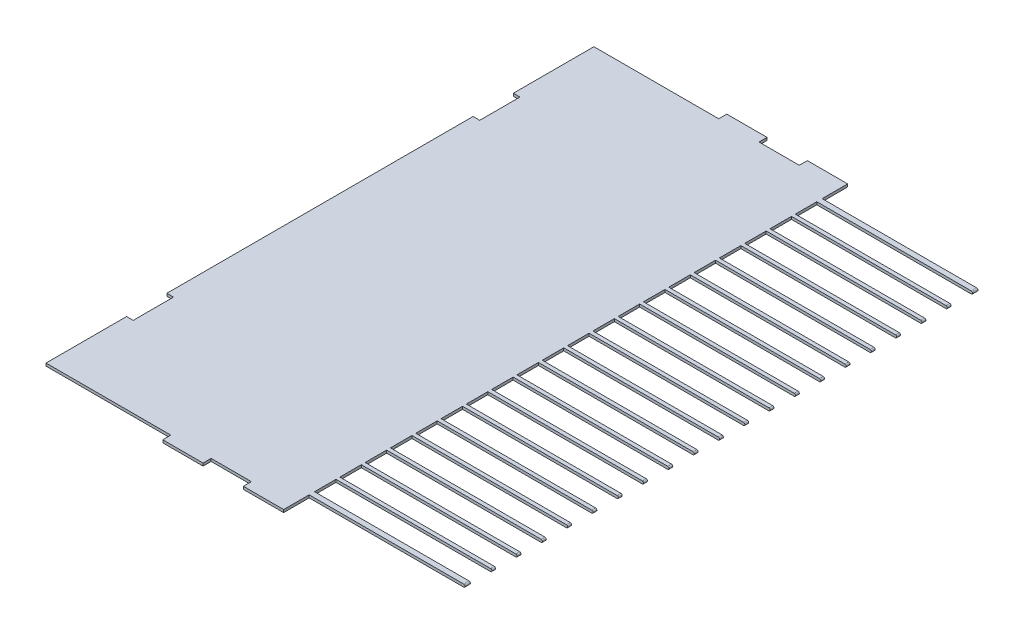
from build123d import *

# Parameters (mm, degrees)
EXTRUDE_1_DEPTH     = 0.5
EXTRUDE_2_DEPTH     = 104.5
SKETCH_8_W          = 60
SKETCH_8_H          = 8
SKETCH_8_W_2        = 60.000005443
CUT_EXTRUDE_2_DEPTH = 10
EXTRUDE_4_DEPTH     = 2.5
SKETCH_7_R          = 3.5
SKETCH_7_R_2        = 0.5
CUT_EXTRUDE_4_DEPTH = 244
SKETCH_10_W         = 3
SKETCH_10_H         = 95.004122321
SKETCH_10_H_2       = 102.964943566
CUT_EXTRUDE_5_DEPTH = 284
SKETCH_11_W         = 204
SKETCH_11_H         = 57
CUT_EXTRUDE_6_DEPTH = 284
SKETCH_13_W         = 2.47
SKETCH_13_H         = 15
CUT_EXTRUDE_7_DEPTH = 284
SKETCH_14_W         = 15
SKETCH_14_H         = 3
EXTRUDE_5_DEPTH     = 1


with BuildPart() as part:
    # 草图1 → 凸台-拉伸1 (new body)
    with BuildSketch(Plane.XY):
        Polygon((0, -1.078212291), (0, -59.078212291), (150, -59.078212291), (150, -56.078212291), (24.720670391, -21.433997855), (24.720670391, -1.078212291), align=None)
    extrude(amount=EXTRUDE_1_DEPTH)

    # 草图2 → 凸台-拉伸2 (add)
    with BuildSketch(Plane(origin=(0, 0, 0), x_dir=(-1, 0, 0), z_dir=(0, 0, -1))):
        with BuildLine():
            Line((-2.47, -1.078212291), (-2.47, -58.078212291))
            Line((-2.47, -58.078212291), (-149, -58.078212291))
            ThreePointArc((-149, -58.078212291), (-149.5, -58.578212291), (-149, -59.078212291))
            Line((-149, -59.078212291), (0, -59.078212291))
            Line((0, -59.078212291), (0, -1.078212291))
            Line((0, -1.078212291), (-2.47, -1.078212291))
        make_face()
    extrude(amount=EXTRUDE_2_DEPTH)

    # 镜向3: part across plane


with BuildPart() as part_1:
    add(part.part)
    add(part.part.mirror(Plane(origin=(149, -58.578212291, -104.5), x_dir=(1, 0, 0), z_dir=(0, 0, -1))))

    # 草图8 → 切除-拉伸2 (cut)
    with BuildSketch(Plane(origin=(0, -58.078212291, 0), x_dir=(1, 0, 0), z_dir=(0, 1, 0))):
        with Locations((121.473716686, 5)):
            Rectangle(SKETCH_8_W, SKETCH_8_H)
        with Locations((121.473713965, 15)):
            Rectangle(SKETCH_8_W_2, SKETCH_8_H)
        with Locations((121.473713965, 24.421052632)):
            Rectangle(SKETCH_8_W_2, SKETCH_8_H)
        with Locations((121.473713965, 33.842105263)):
            Rectangle(SKETCH_8_W_2, SKETCH_8_H)
        with Locations((121.473713965, 43.263157895)):
            Rectangle(SKETCH_8_W_2, SKETCH_8_H)
        with Locations((121.473713965, 52.684210526)):
            Rectangle(SKETCH_8_W_2, SKETCH_8_H)
        with Locations((121.473713965, 62.105263158)):
            Rectangle(SKETCH_8_W_2, SKETCH_8_H)
        with Locations((121.473713965, 71.526315789)):
            Rectangle(SKETCH_8_W_2, SKETCH_8_H)
        with Locations((121.473713965, 80.947368421)):
            Rectangle(SKETCH_8_W_2, SKETCH_8_H)
        with Locations((121.473713965, 90.368421053)):
            Rectangle(SKETCH_8_W_2, SKETCH_8_H)
        with Locations((121.473713965, 99.789473684)):
            Rectangle(SKETCH_8_W_2, SKETCH_8_H)
        with Locations((121.473713965, 109.210526316)):
            Rectangle(SKETCH_8_W_2, SKETCH_8_H)
        with Locations((121.473713965, 118.631578947)):
            Rectangle(SKETCH_8_W_2, SKETCH_8_H)
        with Locations((121.473713965, 128.052631579)):
            Rectangle(SKETCH_8_W_2, SKETCH_8_H)
        with Locations((121.473713965, 137.473684211)):
            Rectangle(SKETCH_8_W_2, SKETCH_8_H)
        with Locations((121.473713965, 146.894736842)):
            Rectangle(SKETCH_8_W_2, SKETCH_8_H)
        with Locations((121.473713965, 156.315789474)):
            Rectangle(SKETCH_8_W_2, SKETCH_8_H)
        with Locations((121.473713965, 165.736842105)):
            Rectangle(SKETCH_8_W_2, SKETCH_8_H)
        with Locations((121.473713965, 175.157894737)):
            Rectangle(SKETCH_8_W_2, SKETCH_8_H)
        with Locations((121.473713965, 184.578947368)):
            Rectangle(SKETCH_8_W_2, SKETCH_8_H)
        with Locations((121.473713965, 194)):
            Rectangle(SKETCH_8_W_2, SKETCH_8_H)
        with Locations((121.473716686, 204)):
            Rectangle(SKETCH_8_W, SKETCH_8_H)
    extrude(amount=-CUT_EXTRUDE_2_DEPTH, mode=Mode.SUBTRACT)

    # 草图1<3> → 凸台-拉伸4 (add)
    with BuildSketch(Plane.XY):
        Polygon((0, -1.078212291), (0, -59.078212291), (150, -59.078212291), (150, -56.078212291), (24.720670391, -21.433997855), (24.720670391, -1.078212291), align=None)
    extrude_4 = extrude(amount=-EXTRUDE_4_DEPTH)

    # 镜向4: 凸台-拉伸4 across plane
    add(extrude_4.mirror(Plane.XY.offset(-104.5)))

    # 镜向5: 凸台-拉伸4 across plane
    add(extrude_4.mirror(Plane.XY.offset(-104.5)))

    # 草图7 → 切除-拉伸4 (cut)
    with BuildSketch(Plane.XY.offset(0.5)):
        with Locations((8, -45.078212291)):
            Circle(SKETCH_7_R)
        with Locations((25, -45.078212291)):
            Circle(SKETCH_7_R_2)
        with Locations((23, -45.078212291)):
            Circle(SKETCH_7_R_2)
    extrude(amount=-CUT_EXTRUDE_4_DEPTH, mode=Mode.SUBTRACT)

    # 草图10 → 切除-拉伸5 (cut)
    with BuildSketch(Plane(origin=(150, 0, 0), x_dir=(0, 0, -1), z_dir=(1, 0, 0))):
        with Locations((1, -11.576151131)):
            Rectangle(SKETCH_10_W, SKETCH_10_H)
        with Locations((208, -7.595740508)):
            Rectangle(SKETCH_10_W, SKETCH_10_H_2)
    extrude(amount=-CUT_EXTRUDE_5_DEPTH, mode=Mode.SUBTRACT)

    # 草图11 → 切除-拉伸6 (cut)
    with BuildSketch(Plane(origin=(2.47, 0, 0), x_dir=(0, 0, -1), z_dir=(1, 0, 0))):
        with Locations((104.5, -29.578212291)):
            Rectangle(SKETCH_11_W, SKETCH_11_H)
    extrude(amount=-CUT_EXTRUDE_6_DEPTH, mode=Mode.SUBTRACT)

    # 草图13 → 切除-拉伸7 (cut)
    with BuildSketch(Plane(origin=(0, -58.078212291, 0), x_dir=(1, 0, 0), z_dir=(0, 1, 0))):
        with Locations((1.235, 40)):
            Rectangle(SKETCH_13_W, SKETCH_13_H)
        with Locations((1.235, 169)):
            Rectangle(SKETCH_13_W, SKETCH_13_H)
    extrude(amount=-CUT_EXTRUDE_7_DEPTH, mode=Mode.SUBTRACT)

    # 草图14 → 凸台-拉伸5 (add)
    with BuildSketch(Plane(origin=(0, -59.078212291, 0), x_dir=(-1, 0, 0), z_dir=(0, -1, 0))):
        with Locations((-83.973716686, 1)):
            Rectangle(SKETCH_14_W, SKETCH_14_H)
        with Locations((-53.973716686, 1)):
            Rectangle(SKETCH_14_W, SKETCH_14_H)
    extrude_5 = extrude(amount=-EXTRUDE_5_DEPTH)

    # 镜向6: 凸台-拉伸5 across plane
    add(extrude_5.mirror(Plane.XY.offset(-104.5)))


solid = part_1.part
